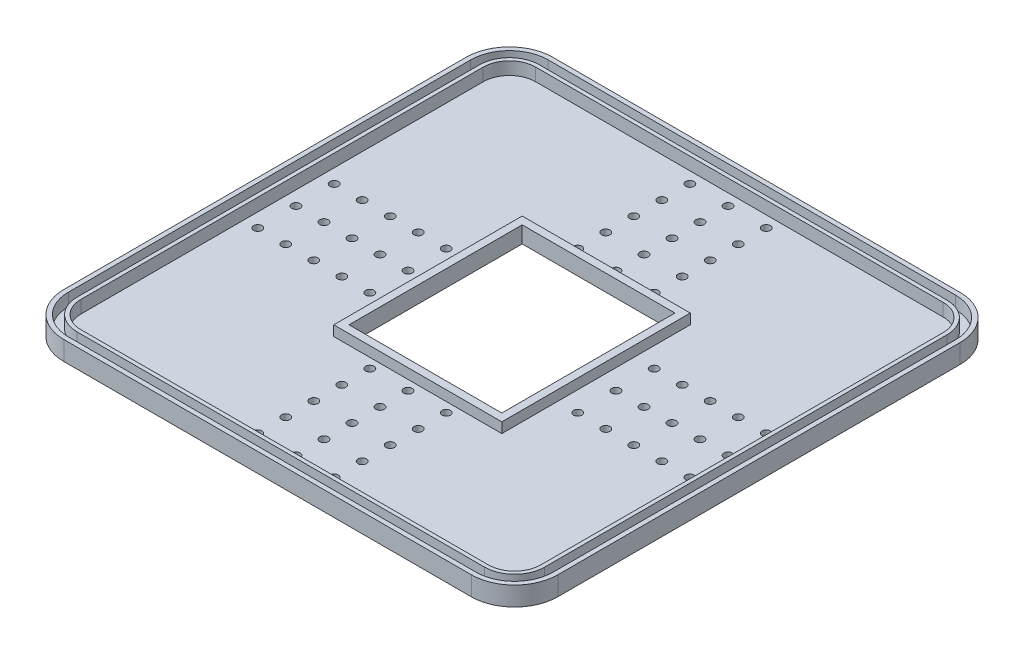
from build123d import *

# Parameters (mm, degrees)
BOSS_EXTRUDE1_DEPTH = 2.5
BOSS_EXTRUDE2_DEPTH = 5
SKETCH4_W           = 60
SKETCH4_H           = 68
CUT_EXTRUDE1_DEPTH  = 5
SKETCH6_W           = 66
SKETCH6_H           = 74
SKETCH6_W_2         = 60
SKETCH6_H_2         = 68
BOSS_EXTRUDE3_DEPTH = 4
SKETCH7_R           = 1.65
CUT_EXTRUDE3_DEPTH  = 2.5


with BuildPart() as part:
    # Sketch1 → Boss-Extrude1 (new body)
    # profile 1 of 2: a face of its own
    with BuildSketch(Plane(origin=(0, 0, 0), x_dir=(1, 0, 0), z_dir=(0, 1, 0))):
        with BuildLine():
            ThreePointArc((-80, -96), (-92.02081528, -91.02081528), (-97, -79))
            Line((-97, -79), (-97, 79))
            ThreePointArc((-97, 79), (-92.02081528, 91.02081528), (-80, 96))
            Line((-80, 96), (80, 96))
            ThreePointArc((80, 96), (92.02081528, 91.02081528), (97, 79))
            Line((97, 79), (97, -79))
            ThreePointArc((97, -79), (92.02081528, -91.02081528), (80, -96))
            Line((80, -96), (-80, -96))
        make_face()
        with BuildLine():
            Line((-95, -79), (-95, 79))
            ThreePointArc((-95, 79), (-90.606601718, 89.606601718), (-80, 94))
            Line((-80, 94), (80, 94))
            ThreePointArc((80, 94), (90.606601718, 89.606601718), (95, 79))
            Line((95, 79), (95, -79))
            ThreePointArc((95, -79), (90.606601718, -89.606601718), (80, -94))
            Line((80, -94), (-80, -94))
            ThreePointArc((-80, -94), (-90.606601718, -89.606601718), (-95, -79))
        make_face(mode=Mode.SUBTRACT)
    # profile 2 of 2: a face of its own
    with BuildSketch(Plane(origin=(0, 0, 0), x_dir=(1, 0, 0), z_dir=(0, 1, 0))):
        with BuildLine():
            ThreePointArc((-95, 79), (-90.606601718, 89.606601718), (-80, 94))
            Line((-80, 94), (80, 94))
            ThreePointArc((80, 94), (90.606601718, 89.606601718), (95, 79))
            Line((95, 79), (95, -79))
            ThreePointArc((95, -79), (90.606601718, -89.606601718), (80, -94))
            Line((80, -94), (-80, -94))
            ThreePointArc((-80, -94), (-90.606601718, -89.606601718), (-95, -79))
            Line((-95, -79), (-95, 79))
        make_face()
    extrude(amount=BOSS_EXTRUDE1_DEPTH)

    # Sketch3 → Boss-Extrude2 (add)
    # profile 1 of 2: a face of its own
    with BuildSketch(Plane(origin=(0, 2.5, 0), x_dir=(1, 0, 0), z_dir=(0, 1, 0))):
        with BuildLine():
            Line((-97, 79), (-97, -79))
            ThreePointArc((-97, -79), (-92.02081528, -91.02081528), (-80, -96))
            Line((-80, -96), (80, -96))
            ThreePointArc((80, -96), (92.02081528, -91.02081528), (97, -79))
            Line((97, -79), (97, 79))
            ThreePointArc((97, 79), (92.02081528, 91.02081528), (80, 96))
            Line((80, 96), (-80, 96))
            ThreePointArc((-80, 96), (-92.02081528, 91.02081528), (-97, 79))
        make_face()
        with BuildLine():
            ThreePointArc((-95.2, -79), (-90.748023074, -89.748023074), (-80, -94.2))
            Line((-80, -94.2), (80, -94.2))
            ThreePointArc((80, -94.2), (90.748023074, -89.748023074), (95.2, -79))
            Line((95.2, -79), (95.2, 79))
            ThreePointArc((95.2, 79), (90.748023074, 89.748023074), (80, 94.2))
            Line((80, 94.2), (-80, 94.2))
            ThreePointArc((-80, 94.2), (-90.748023074, 89.748023074), (-95.2, 79))
            Line((-95.2, 79), (-95.2, -79))
        make_face(mode=Mode.SUBTRACT)
    # profile 2 of 2: a face of its own
    with BuildSketch(Plane(origin=(0, 2.5, 0), x_dir=(1, 0, 0), z_dir=(0, 1, 0))):
        with BuildLine():
            Line((-91.8, 79), (-91.8, -79))
            ThreePointArc((-91.8, -79), (-88.343860018, -87.343860018), (-80, -90.8))
            Line((-80, -90.8), (80, -90.8))
            ThreePointArc((80, -90.8), (88.343860018, -87.343860018), (91.8, -79))
            Line((91.8, -79), (91.8, 79))
            ThreePointArc((91.8, 79), (88.343860018, 87.343860018), (80, 90.8))
            Line((80, 90.8), (-80, 90.8))
            ThreePointArc((-80, 90.8), (-88.343860018, 87.343860018), (-91.8, 79))
        make_face()
        with BuildLine():
            ThreePointArc((-80, 89.3), (-87.283199846, 86.283199846), (-90.3, 79))
            Line((-90.3, 79), (-90.3, -79))
            ThreePointArc((-90.3, -79), (-87.283199846, -86.283199846), (-80, -89.3))
            Line((-80, -89.3), (80, -89.3))
            ThreePointArc((80, -89.3), (87.283199846, -86.283199846), (90.3, -79))
            Line((90.3, -79), (90.3, 79))
            ThreePointArc((90.3, 79), (87.283199846, 86.283199846), (80, 89.3))
            Line((80, 89.3), (-80, 89.3))
        make_face(mode=Mode.SUBTRACT)
    extrude(amount=BOSS_EXTRUDE2_DEPTH)

    # Sketch4 → Cut-Extrude1 (cut)
    with BuildSketch(Plane(origin=(0, 2.5, 0), x_dir=(1, 0, 0), z_dir=(0, 1, 0))):
        Rectangle(SKETCH4_W, SKETCH4_H)
    extrude(amount=-CUT_EXTRUDE1_DEPTH, mode=Mode.SUBTRACT)

    # Sketch6 → Boss-Extrude3 (add)
    with BuildSketch(Plane(origin=(0, 2.5, 0), x_dir=(1, 0, 0), z_dir=(0, 1, 0))):
        Rectangle(SKETCH6_W, SKETCH6_H)
        Rectangle(SKETCH6_W_2, SKETCH6_H_2, mode=Mode.SUBTRACT)
    extrude(amount=BOSS_EXTRUDE3_DEPTH)

    # Sketch7 → Cut-Extrude3 (cut)
    with BuildSketch(Plane(origin=(0, 2.5, 0), x_dir=(1, 0, 0), z_dir=(0, 1, 0))):
        with Locations(Location((-84.834554705, 15, 0), (0, 0, 270))):
            Circle(SKETCH7_R)
        with Locations(Location((-73.834554705, 15, 0), (0, 0, 270))):
            Circle(SKETCH7_R)
        with Locations(Location((-62.834554705, 15, 0), (0, 0, 270))):
            Circle(SKETCH7_R)
        with Locations(Location((-51.834554705, 15, 0), (0, 0, 270))):
            Circle(SKETCH7_R)
        with Locations(Location((-40.834554705, 15, 0), (0, 0, 270))):
            Circle(SKETCH7_R)
        with Locations(Location((-40.834554705, 0, 0), (0, 0, 270))):
            Circle(SKETCH7_R)
        with Locations(Location((-51.834554705, 0, 0), (0, 0, 270))):
            Circle(SKETCH7_R)
        with Locations(Location((-62.834554705, 0, 0), (0, 0, 270))):
            Circle(SKETCH7_R)
        with Locations(Location((-73.834554705, 0, 0), (0, 0, 270))):
            Circle(SKETCH7_R)
        with Locations(Location((-84.834554705, 0, 0), (0, 0, 270))):
            Circle(SKETCH7_R)
        with Locations(Location((-84.834554705, -15, 0), (0, 0, 270))):
            Circle(SKETCH7_R)
        with Locations(Location((-73.834554705, -15, 0), (0, 0, 270))):
            Circle(SKETCH7_R)
        with Locations(Location((-62.834554705, -15, 0), (0, 0, 270))):
            Circle(SKETCH7_R)
        with Locations(Location((-51.834554705, -15, 0), (0, 0, 270))):
            Circle(SKETCH7_R)
        with Locations(Location((-40.834554705, -15, 0), (0, 0, 270))):
            Circle(SKETCH7_R)
        with Locations(Location((15, 84.834554705, 0), (0, 0, 270))):
            Circle(SKETCH7_R)
        with Locations(Location((15, 73.834554705, 0), (0, 0, 270))):
            Circle(SKETCH7_R)
        with Locations(Location((15, 62.834554705, 0), (0, 0, 270))):
            Circle(SKETCH7_R)
        with Locations(Location((15, 51.834554705, 0), (0, 0, 270))):
            Circle(SKETCH7_R)
        with Locations(Location((15, 40.834554705, 0), (0, 0, 270))):
            Circle(SKETCH7_R)
        with Locations(Location((0, 40.834554705, 0), (0, 0, 270))):
            Circle(SKETCH7_R)
        with Locations(Location((0, 51.834554705, 0), (0, 0, 270))):
            Circle(SKETCH7_R)
        with Locations(Location((0, 62.834554705, 0), (0, 0, 270))):
            Circle(SKETCH7_R)
        with Locations(Location((0, 73.834554705, 0), (0, 0, 270))):
            Circle(SKETCH7_R)
        with Locations(Location((0, 84.834554705, 0), (0, 0, 270))):
            Circle(SKETCH7_R)
        with Locations(Location((-15, 84.834554705, 0), (0, 0, 270))):
            Circle(SKETCH7_R)
        with Locations(Location((-15, 73.834554705, 0), (0, 0, 270))):
            Circle(SKETCH7_R)
        with Locations(Location((-15, 62.834554705, 0), (0, 0, 270))):
            Circle(SKETCH7_R)
        with Locations(Location((-15, 51.834554705, 0), (0, 0, 270))):
            Circle(SKETCH7_R)
        with Locations(Location((-15, 40.834554705, 0), (0, 0, 270))):
            Circle(SKETCH7_R)
        with Locations(Location((84.834554705, -15, 0), (0, 0, 270))):
            Circle(SKETCH7_R)
        with Locations(Location((73.834554705, -15, 0), (0, 0, 270))):
            Circle(SKETCH7_R)
        with Locations(Location((62.834554705, -15, 0), (0, 0, 270))):
            Circle(SKETCH7_R)
        with Locations(Location((51.834554705, -15, 0), (0, 0, 270))):
            Circle(SKETCH7_R)
        with Locations(Location((40.834554705, -15, 0), (0, 0, 270))):
            Circle(SKETCH7_R)
        with Locations(Location((40.834554705, 0, 0), (0, 0, 270))):
            Circle(SKETCH7_R)
        with Locations(Location((51.834554705, 0, 0), (0, 0, 270))):
            Circle(SKETCH7_R)
        with Locations(Location((62.834554705, 0, 0), (0, 0, 270))):
            Circle(SKETCH7_R)
        with Locations(Location((73.834554705, 0, 0), (0, 0, 270))):
            Circle(SKETCH7_R)
        with Locations(Location((84.834554705, 0, 0), (0, 0, 270))):
            Circle(SKETCH7_R)
        with Locations(Location((84.834554705, 15, 0), (0, 0, 270))):
            Circle(SKETCH7_R)
        with Locations(Location((73.834554705, 15, 0), (0, 0, 270))):
            Circle(SKETCH7_R)
        with Locations(Location((62.834554705, 15, 0), (0, 0, 270))):
            Circle(SKETCH7_R)
        with Locations(Location((51.834554705, 15, 0), (0, 0, 270))):
            Circle(SKETCH7_R)
        with Locations(Location((40.834554705, 15, 0), (0, 0, 270))):
            Circle(SKETCH7_R)
        with Locations(Location((-15, -84.834554705, 0), (0, 0, 270))):
            Circle(SKETCH7_R)
        with Locations(Location((-15, -73.834554705, 0), (0, 0, 270))):
            Circle(SKETCH7_R)
        with Locations(Location((-15, -62.834554705, 0), (0, 0, 270))):
            Circle(SKETCH7_R)
        with Locations(Location((-15, -51.834554705, 0), (0, 0, 270))):
            Circle(SKETCH7_R)
        with Locations(Location((-15, -40.834554705, 0), (0, 0, 270))):
            Circle(SKETCH7_R)
        with Locations(Location((0, -40.834554705, 0), (0, 0, 270))):
            Circle(SKETCH7_R)
        with Locations(Location((0, -51.834554705, 0), (0, 0, 270))):
            Circle(SKETCH7_R)
        with Locations(Location((0, -62.834554705, 0), (0, 0, 270))):
            Circle(SKETCH7_R)
        with Locations(Location((0, -73.834554705, 0), (0, 0, 270))):
            Circle(SKETCH7_R)
        with Locations(Location((0, -84.834554705, 0), (0, 0, 270))):
            Circle(SKETCH7_R)
        with Locations(Location((15, -84.834554705, 0), (0, 0, 270))):
            Circle(SKETCH7_R)
        with Locations(Location((15, -73.834554705, 0), (0, 0, 270))):
            Circle(SKETCH7_R)
        with Locations(Location((15, -62.834554705, 0), (0, 0, 270))):
            Circle(SKETCH7_R)
        with Locations(Location((15, -51.834554705, 0), (0, 0, 270))):
            Circle(SKETCH7_R)
        with Locations(Location((15, -40.834554705, 0), (0, 0, 270))):
            Circle(SKETCH7_R)
    extrude(amount=-CUT_EXTRUDE3_DEPTH, mode=Mode.SUBTRACT)


solid = part.part
